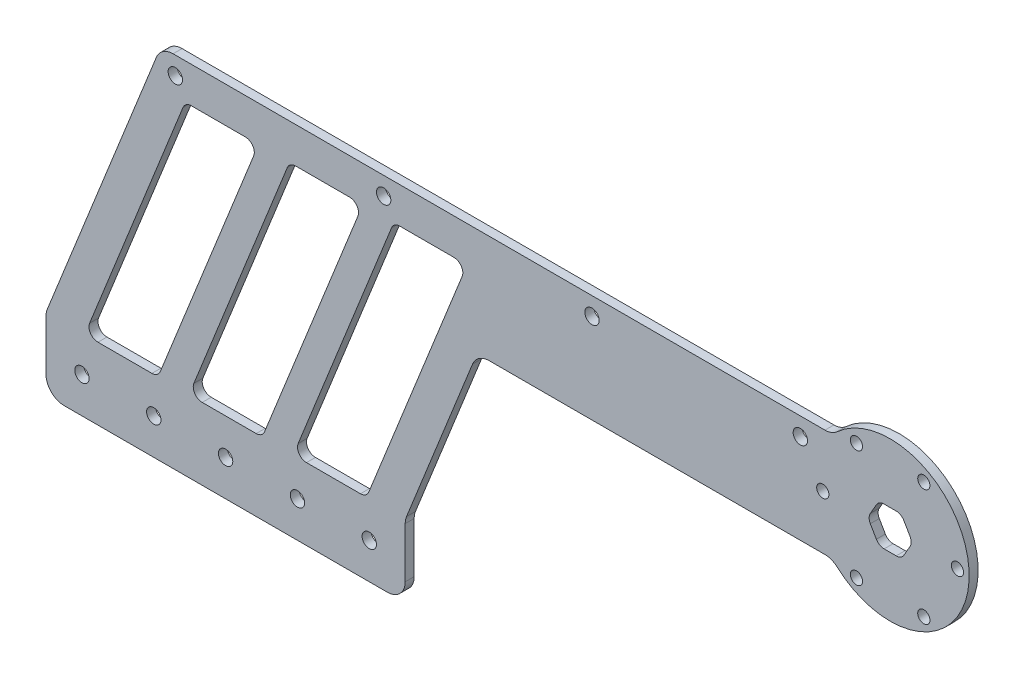
from build123d import *

# Parameters (mm, degrees)
SKETCH1_R           = 2.54
SKETCH1_R_2         = 2.159
BOSS_EXTRUDE1_DEPTH = 3.175
FILLET1_R           = 6.35
CUT_EXTRUDE1_DEPTH  = 354.562731103
FILLET2_R           = 3.175
SKETCH3_R           = 2.54
CUT_EXTRUDE2_DEPTH  = 354.562731103
FILLET3_R           = 3.175


with BuildPart() as part:
    # Sketch1 → Boss-Extrude1 (new body)
    with BuildSketch(Plane.XY):
        with BuildLine():
            Line((40.64, 127), (0, 25.4))
            Line((0, 25.4), (0, 0))
            Line((0, 0), (127, 0))
            Line((127, 0), (127, 25.4))
            Line((127, 25.4), (152.4, 88.9))
            Line((152.4, 88.9), (278.011284287, 88.9))
            ThreePointArc((278.011284287, 88.9), (326.39, 107.95), (278.011284287, 127))
            Line((278.011284287, 127), (40.64, 127))
        make_face()
        with Locations((12.7, 12.7)):
            Circle(SKETCH1_R, mode=Mode.SUBTRACT)
        with Locations((38.1, 12.7)):
            Circle(SKETCH1_R, mode=Mode.SUBTRACT)
        with Locations((63.5, 12.7)):
            Circle(SKETCH1_R, mode=Mode.SUBTRACT)
        with Locations((88.9, 12.7)):
            Circle(SKETCH1_R, mode=Mode.SUBTRACT)
        with Locations((114.3, 12.7)):
            Circle(SKETCH1_R, mode=Mode.SUBTRACT)
        with Locations((286.54375, 128.572229928)):
            Circle(SKETCH1_R_2, mode=Mode.SUBTRACT)
        with Locations((310.35625, 128.572229928)):
            Circle(SKETCH1_R_2, mode=Mode.SUBTRACT)
        with Locations((310.35625, 87.327770072)):
            Circle(SKETCH1_R_2, mode=Mode.SUBTRACT)
        with Locations((286.54375, 87.327770072)):
            Circle(SKETCH1_R_2, mode=Mode.SUBTRACT)
        Polygon((302.409468146, 101.092), (294.490531854, 101.092), (290.531063708, 107.95), (294.490531854, 114.808), (302.409468146, 114.808), (306.368936292, 107.95), align=None, mode=Mode.SUBTRACT)
        with Locations((274.6375, 107.95)):
            Circle(SKETCH1_R_2, mode=Mode.SUBTRACT)
        with Locations((322.2625, 107.95)):
            Circle(SKETCH1_R_2, mode=Mode.SUBTRACT)
    extrude(amount=BOSS_EXTRUDE1_DEPTH)

    # Fillet1
    fillet1_edges = [part.edges().sort_by_distance(p)[0] for p in [
        (278.011284287, 88.9, 1.5875),
        (152.4, 88.9, 1.5875),
        (127, 25.4, 1.5875),
        (127, 0, 1.5875),
        (0, 0, 1.5875),
        (0, 25.4, 1.5875),
        (40.64, 127, 1.5875),
        (278.011284287, 127, 1.5875),
    ]]
    fillet(fillet1_edges, radius=FILLET1_R)

    # Sketch2 → Cut-Extrude1 (cut, through all)
    with BuildSketch(Plane.XY.offset(3.175)):
        Polygon((49.23831861, 114.3), (13.67831861, 25.4), (39.597669611, 25.4), (75.157669611, 114.3), align=None)
        Polygon((86.100324499, 114.3), (50.540324499, 25.4), (76.459675501, 25.4), (112.019675501, 114.3), align=None)
        Polygon((122.962330389, 114.3), (87.402330389, 25.4), (113.32168139, 25.4), (148.88168139, 114.3), align=None)
    extrude(amount=-CUT_EXTRUDE1_DEPTH, mode=Mode.SUBTRACT)

    # Fillet2
    fillet2_edges = [part.edges().sort_by_distance(p)[0] for p in [
        (76.459675501, 25.4, 1.5875),
        (50.540324499, 25.4, 1.5875),
        (86.100324499, 114.3, 1.5875),
        (112.019675501, 114.3, 1.5875),
        (148.88168139, 114.3, 1.5875),
        (113.32168139, 25.4, 1.5875),
        (87.402330389, 25.4, 1.5875),
        (122.962330389, 114.3, 1.5875),
        (39.597669611, 25.4, 1.5875),
        (13.67831861, 25.4, 1.5875),
        (49.23831861, 114.3, 1.5875),
        (75.157669611, 114.3, 1.5875),
    ]]
    fillet(fillet2_edges, radius=FILLET2_R)

    # Sketch3 → Cut-Extrude2 (cut, through all)
    with BuildSketch(Plane.XY.offset(3.175)):
        with Locations((45.72, 120.65)):
            Circle(SKETCH3_R)
        with Locations((119.38, 120.65)):
            Circle(SKETCH3_R)
        with Locations((193.04, 120.65)):
            Circle(SKETCH3_R)
        with Locations((266.7, 120.65)):
            Circle(SKETCH3_R)
    extrude(amount=-CUT_EXTRUDE2_DEPTH, mode=Mode.SUBTRACT)

    # Fillet3
    fillet3_edges = [part.edges().sort_by_distance(p)[0] for p in [
        (302.409468146, 101.092, 1.5875),
        (306.368936292, 107.95, 1.5875),
        (302.409468146, 114.808, 1.5875),
        (294.490531854, 114.808, 1.5875),
        (290.531063708, 107.95, 1.5875),
        (294.490531854, 101.092, 1.5875),
    ]]
    fillet(fillet3_edges, radius=FILLET3_R)


solid = part.part
